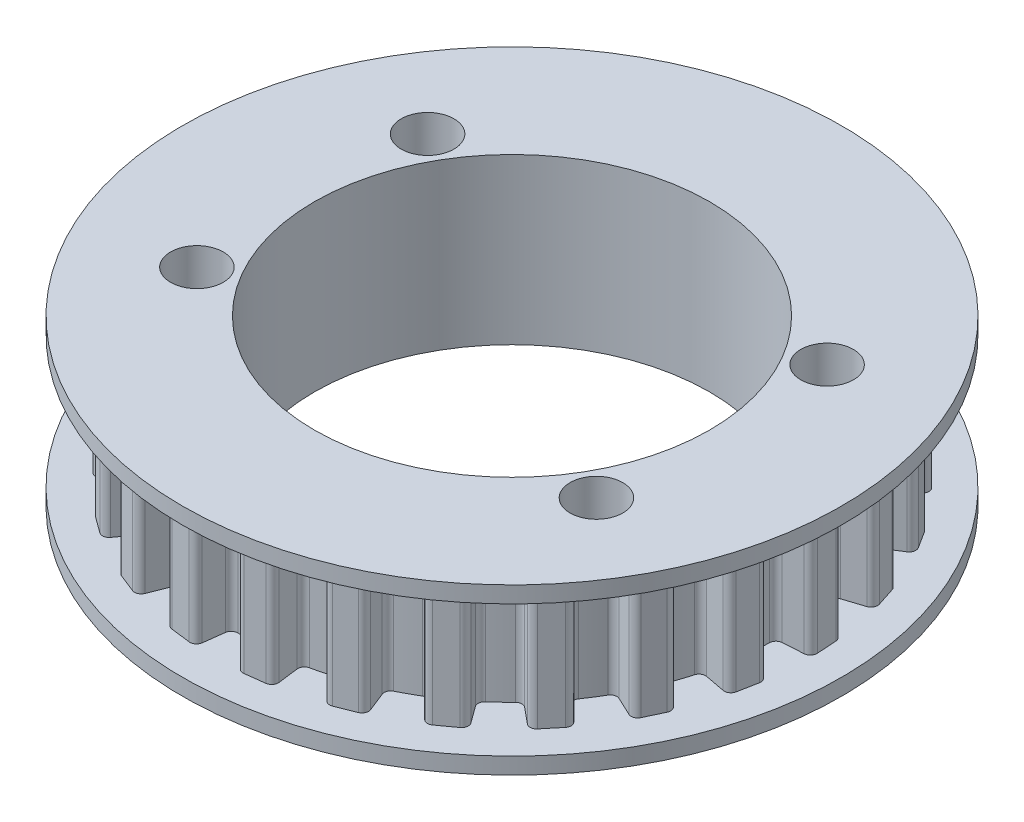
from build123d import *

# Parameters (mm, degrees)
CROQUIS1_R              = 30
SALIENTE_EXTRUIR1_DEPTH = 10
CROQUIS2_R              = 50
SALIENTE_EXTRUIR2_DEPTH = 2.5
SALIENTE_EXTRUIR3_START = 2.5
CROQUIS3_R              = 50
SALIENTE_EXTRUIR3_DEPTH = 2.5
CROQUIS4_R              = 30
CORTAR_EXTRUIR1_DEPTH   = 12.5
CROQUIS6_R              = 4
CORTAR_EXTRUIR2_DEPTH   = 10


with BuildPart() as part:
    # Croquis1 → Saliente-Extruir1 (new, symmetric)
    with BuildSketch(Plane(origin=(0, 0, 0), x_dir=(1, 0, 0), z_dir=(0, 1, 0))):
        with BuildLine():
            Line((-1.5, 45), (1.5, 45))
            ThreePointArc((1.5, 45), (2.207106781, 44.707106781), (2.5, 44))
            Line((2.5, 44), (2.5, 40.850336596))
            ThreePointArc((2.5, 40.850336596), (2.763329839, 40.17408437), (3.414634146, 39.853986923))
            ThreePointArc((3.414634146, 39.853986923), (5.013329343, 39.684588053), (6.603926375, 39.451085618))
            ThreePointArc((6.603926375, 39.451085618), (7.314373759, 39.59915382), (7.737607696, 40.188672871))
            Line((7.737607696, 40.188672871), (8.520897132, 43.239383808))
            ThreePointArc((8.520897132, 43.239383808), (8.980438878, 43.851435947), (9.738170181, 43.959277082))
            Line((9.738170181, 43.959277082), (12.643919664, 43.21320742))
            ThreePointArc((12.643919664, 43.21320742), (13.255971804, 42.753665675), (13.363812938, 41.995934372))
            Line((13.363812938, 41.995934372), (12.580523502, 38.945223435))
            ThreePointArc((12.580523502, 38.945223435), (12.667403259, 38.224729449), (13.218640646, 37.752715657))
            ThreePointArc((13.218640646, 37.752715657), (14.724982107, 37.191059436), (16.207537915, 36.569327513))
            ThreePointArc((16.207537915, 36.569327513), (16.932488352, 36.5360628), (17.489033043, 37.001807026))
            Line((17.489033043, 37.001807026), (19.00639496, 39.761878107))
            ThreePointArc((19.00639496, 39.761878107), (19.603710534, 40.240418119), (20.364455315, 40.156431113))
            Line((20.364455315, 40.156431113), (22.993375355, 38.711170091))
            ThreePointArc((22.993375355, 38.711170091), (23.471915366, 38.113854517), (23.387928361, 37.353109737))
            Line((23.387928361, 37.353109737), (21.870566443, 34.593038656))
            ThreePointArc((21.870566443, 34.593038656), (21.775537146, 33.873574196), (22.19207134, 33.279302421))
            ThreePointArc((22.19207134, 33.279302421), (23.511410092, 32.360679775), (24.792770241, 31.389784067))
            ThreePointArc((24.792770241, 31.389784067), (25.486672429, 31.177276585), (26.141558124, 31.489981563))
            Line((26.141558124, 31.489981563), (28.297651092, 33.785987371))
            ThreePointArc((28.297651092, 33.785987371), (28.995208961, 34.100946826), (29.711166826, 33.830408893))
            Line((29.711166826, 33.830408893), (31.898072708, 31.776767575))
            ThreePointArc((31.898072708, 31.776767575), (32.213032162, 31.079209707), (31.942494229, 30.363251842))
            Line((31.942494229, 30.363251842), (29.786401262, 28.067246033))
            ThreePointArc((29.786401262, 28.067246033), (29.515433948, 27.394017697), (29.771092575, 26.714828222))
            ThreePointArc((29.771092575, 26.714828222), (30.820529711, 25.49695959), (31.820181631, 24.237905045))
            ThreePointArc((31.820181631, 24.237905045), (32.439435144, 23.859507419), (33.151512967, 23.999524746))
            Line((33.151512967, 23.999524746), (35.810861735, 25.687198793))
            ThreePointArc((35.810861735, 25.687198793), (36.564831771, 25.818787629), (37.191016455, 25.378697662))
            Line((37.191016455, 25.378697662), (38.79849684, 22.845713886))
            ThreePointArc((38.79849684, 22.845713886), (38.930085676, 22.091743849), (38.48999571, 21.465559165))
            Line((38.48999571, 21.465559165), (35.830646942, 19.777885118))
            ThreePointArc((35.830646942, 19.777885118), (35.400767486, 19.193194319), (35.479486572, 18.471763115))
            ThreePointArc((35.479486572, 18.471763115), (36.193082099, 17.031171663), (36.848213983, 15.563069308))
            ThreePointArc((36.848213983, 15.563069308), (37.353908845, 15.042557653), (38.078436326, 15.001089525))
            Line((38.078436326, 15.001089525), (41.073944231, 15.974389043))
            ThreePointArc((41.073944231, 15.974389043), (41.836951725, 15.914339051), (42.334017742, 15.332349521))
            Line((42.334017742, 15.332349521), (43.261068725, 12.479179972))
            ThreePointArc((43.261068725, 12.479179972), (43.201018733, 11.716172478), (42.619029203, 11.219106462))
            Line((42.619029203, 11.219106462), (39.623521298, 10.245806943))
            ThreePointArc((39.623521298, 10.245806943), (39.061740607, 9.786391954), (38.958573944, 9.068049197))
            ThreePointArc((38.958573944, 9.068049197), (39.291490029, 7.495252583), (39.560937531, 5.91034869))
            ThreePointArc((39.560937531, 5.91034869), (39.921299075, 5.280428667), (40.612751489, 5.060080679))
            Line((40.612751489, 5.060080679), (43.756199752, 5.25784968))
            ThreePointArc((43.756199752, 5.25784968), (44.480302137, 5.009934022), (44.817017, 4.322613471))
            Line((44.817017, 4.322613471), (45.005388559, 1.328533286))
            ThreePointArc((45.005388559, 1.328533286), (44.7574729, 0.604430901), (44.07015235, 0.267716038))
            Line((44.07015235, 0.267716038), (40.926704087, 0.069947037))
            ThreePointArc((40.926704087, 0.069947037), (40.268320908, -0.235325409), (39.989750835, -0.905443602))
            ThreePointArc((39.989750835, -0.905443602), (39.921069137, -2.511620781), (39.78790188, -4.113740873))
            ThreePointArc((39.78790188, -4.113740873), (39.980287264, -4.813489072), (40.595218113, -5.198871646))
            Line((40.595218113, -5.198871646), (43.689092319, -5.789059715))
            ThreePointArc((43.689092319, -5.789059715), (44.328791578, -6.209263588), (44.483998255, -6.95872828))
            Line((44.483998255, -6.95872828), (43.921854311, -9.905590032))
            ThreePointArc((43.921854311, -9.905590032), (43.501650438, -10.545289292), (42.752185746, -10.700495969))
            Line((42.752185746, -10.700495969), (39.65831154, -10.110307899))
            ThreePointArc((39.65831154, -10.110307899), (38.944694508, -10.242256411), (38.50822461, -10.822044049))
            ThreePointArc((38.50822461, -10.822044049), (38.042260652, -12.360679775), (37.514846024, -13.879348968))
            ThreePointArc((37.514846024, -13.879348968), (37.527166967, -14.60495759), (38.026937883, -15.131159745))
            Line((38.026937883, -15.131159745), (40.876838537, -16.472221198))
            ThreePointArc((40.876838537, -16.472221198), (41.391940015, -17.03831033), (41.355886298, -17.802827542))
            Line((41.355886298, -17.802827542), (40.078548424, -20.517308699))
            ThreePointArc((40.078548424, -20.517308699), (39.512459291, -21.032410177), (38.74794208, -20.99635646))
            Line((38.74794208, -20.99635646), (35.898041425, -19.655295007))
            ThreePointArc((35.898041425, -19.655295007), (35.174029725, -19.605628775), (34.607085009, -20.058655668))
            ThreePointArc((34.607085009, -20.058655668), (33.77311702, -21.433071799), (32.884594423, -22.772866523))
            ThreePointArc((32.884594423, -22.772866523), (32.716076754, -23.478742909), (33.069285293, -24.112701429))
            Line((33.069285293, -24.112701429), (35.496142657, -26.120372442))
            ThreePointArc((35.496142657, -26.120372442), (35.854280631, -26.796777371), (35.62923191, -27.528309675))
            Line((35.62923191, -27.528309675), (33.71695994, -29.839849403))
            ThreePointArc((33.71695994, -29.839849403), (33.040555011, -30.197987378), (32.309022708, -29.972938656))
            Line((32.309022708, -29.972938656), (29.882165345, -27.965267642))
            ThreePointArc((29.882165345, -27.965267642), (29.193251293, -27.737107378), (28.53145498, -28.034908181))
            ThreePointArc((28.53145498, -28.034908181), (27.381884237, -29.158745097), (26.188082812, -30.235481121))
            ThreePointArc((26.188082812, -30.235481121), (25.849315117, -30.877272462), (26.033767888, -31.579153401))
            Line((26.033767888, -31.579153401), (27.885093587, -34.127284622))
            ThreePointArc((27.885093587, -34.127284622), (28.063764933, -34.871504339), (27.663861845, -35.524086868))
            Line((27.663861845, -35.524086868), (25.236810862, -37.287442625))
            ThreePointArc((25.236810862, -37.287442625), (24.492591144, -37.466113972), (23.840008615, -37.066210883))
            Line((23.840008615, -37.066210883), (21.988682916, -34.518079663))
            ThreePointArc((21.988682916, -34.518079663), (21.378153517, -34.125761515), (20.663088704, -34.249624307))
            ThreePointArc((20.663088704, -34.249624307), (19.270146964, -35.052267202), (17.846077646, -35.798289242))
            ThreePointArc((17.846077646, -35.798289242), (17.358345945, -36.335669429), (17.362453101, -37.061371026))
            Line((17.362453101, -37.061371026), (18.521921533, -39.989853997))
            ThreePointArc((18.521921533, -39.989853997), (18.509899673, -40.755126441), (17.9602696, -41.287755036))
            Line((17.9602696, -41.287755036), (15.170940142, -42.392128694))
            ThreePointArc((15.170940142, -42.392128694), (14.405667699, -42.380106834), (13.873039103, -41.830476761))
            Line((13.873039103, -41.830476761), (12.713570672, -38.901993789))
            ThreePointArc((12.713570672, -38.901993789), (12.219787732, -38.37016855), (11.496384571, -38.312310577))
            ThreePointArc((11.496384571, -38.312310577), (9.947595487, -38.743326445), (8.382737788, -39.111759193))
            ThreePointArc((8.382737788, -39.111759193), (7.776688057, -39.510962651), (7.600191531, -40.214886407))
            Line((7.600191531, -40.214886407), (7.99494903, -43.339713774))
            ThreePointArc((7.99494903, -43.339713774), (7.792989341, -44.077954061), (7.128167562, -44.457161709))
            Line((7.128167562, -44.457161709), (4.151823458, -44.833161409))
            ThreePointArc((4.151823458, -44.833161409), (3.413583171, -44.631201721), (3.034375524, -43.966379942))
            Line((3.034375524, -43.966379942), (2.639618024, -40.841552574))
            ThreePointArc((2.639618024, -40.841552574), (2.293607742, -40.203636779), (1.607320315, -39.967693471))
            ThreePointArc((1.607320315, -39.967693471), (0, -40), (-1.607320315, -39.967693471))
            ThreePointArc((-1.607320315, -39.967693471), (-2.293607742, -40.203636779), (-2.639618024, -40.841552574))
            Line((-2.639618024, -40.841552574), (-3.034375524, -43.966379942))
            ThreePointArc((-3.034375524, -43.966379942), (-3.413583171, -44.631201721), (-4.151823458, -44.833161409))
            Line((-4.151823458, -44.833161409), (-7.128167562, -44.457161709))
            ThreePointArc((-7.128167562, -44.457161709), (-7.792989341, -44.077954061), (-7.99494903, -43.339713774))
            Line((-7.99494903, -43.339713774), (-7.600191531, -40.214886407))
            ThreePointArc((-7.600191531, -40.214886407), (-7.776688057, -39.510962651), (-8.382737788, -39.111759193))
            ThreePointArc((-8.382737788, -39.111759193), (-9.947595487, -38.743326445), (-11.496384571, -38.312310577))
            ThreePointArc((-11.496384571, -38.312310577), (-12.219787732, -38.37016855), (-12.713570672, -38.901993789))
            Line((-12.713570672, -38.901993789), (-13.873039103, -41.830476761))
            ThreePointArc((-13.873039103, -41.830476761), (-14.405667699, -42.380106834), (-15.170940142, -42.392128694))
            Line((-15.170940142, -42.392128694), (-17.9602696, -41.287755036))
            ThreePointArc((-17.9602696, -41.287755036), (-18.509899673, -40.755126441), (-18.521921533, -39.989853997))
            Line((-18.521921533, -39.989853997), (-17.362453101, -37.061371026))
            ThreePointArc((-17.362453101, -37.061371026), (-17.358345945, -36.335669429), (-17.846077646, -35.798289242))
            ThreePointArc((-17.846077646, -35.798289242), (-19.270146964, -35.052267202), (-20.663088704, -34.249624307))
            ThreePointArc((-20.663088704, -34.249624307), (-21.378153517, -34.125761515), (-21.988682916, -34.518079663))
            Line((-21.988682916, -34.518079663), (-23.840008615, -37.066210883))
            ThreePointArc((-23.840008615, -37.066210883), (-24.492591144, -37.466113972), (-25.236810862, -37.287442625))
            Line((-25.236810862, -37.287442625), (-27.663861845, -35.524086868))
            ThreePointArc((-27.663861845, -35.524086868), (-28.063764933, -34.871504339), (-27.885093587, -34.127284622))
            Line((-27.885093587, -34.127284622), (-26.033767888, -31.579153401))
            ThreePointArc((-26.033767888, -31.579153401), (-25.849315117, -30.877272462), (-26.188082812, -30.235481121))
            ThreePointArc((-26.188082812, -30.235481121), (-27.381884237, -29.158745097), (-28.53145498, -28.034908181))
            ThreePointArc((-28.53145498, -28.034908181), (-29.193251293, -27.737107378), (-29.882165345, -27.965267642))
            Line((-29.882165345, -27.965267642), (-32.309022708, -29.972938656))
            ThreePointArc((-32.309022708, -29.972938656), (-33.040555011, -30.197987378), (-33.71695994, -29.839849403))
            Line((-33.71695994, -29.839849403), (-35.62923191, -27.528309675))
            ThreePointArc((-35.62923191, -27.528309675), (-35.854280631, -26.796777371), (-35.496142657, -26.120372442))
            Line((-35.496142657, -26.120372442), (-33.069285293, -24.112701429))
            ThreePointArc((-33.069285293, -24.112701429), (-32.716076754, -23.478742909), (-32.884594423, -22.772866523))
            ThreePointArc((-32.884594423, -22.772866523), (-33.77311702, -21.433071799), (-34.607085009, -20.058655668))
            ThreePointArc((-34.607085009, -20.058655668), (-35.174029725, -19.605628775), (-35.898041425, -19.655295007))
            Line((-35.898041425, -19.655295007), (-38.74794208, -20.99635646))
            ThreePointArc((-38.74794208, -20.99635646), (-39.512459291, -21.032410177), (-40.078548424, -20.517308699))
            Line((-40.078548424, -20.517308699), (-41.355886298, -17.802827542))
            ThreePointArc((-41.355886298, -17.802827542), (-41.391940015, -17.03831033), (-40.876838537, -16.472221198))
            Line((-40.876838537, -16.472221198), (-38.026937883, -15.131159745))
            ThreePointArc((-38.026937883, -15.131159745), (-37.527166967, -14.60495759), (-37.514846024, -13.879348968))
            ThreePointArc((-37.514846024, -13.879348968), (-38.042260652, -12.360679775), (-38.50822461, -10.822044049))
            ThreePointArc((-38.50822461, -10.822044049), (-38.944694508, -10.242256411), (-39.65831154, -10.110307899))
            Line((-39.65831154, -10.110307899), (-42.752185746, -10.700495969))
            ThreePointArc((-42.752185746, -10.700495969), (-43.501650438, -10.545289292), (-43.921854311, -9.905590032))
            Line((-43.921854311, -9.905590032), (-44.483998255, -6.95872828))
            ThreePointArc((-44.483998255, -6.95872828), (-44.328791578, -6.209263588), (-43.689092319, -5.789059715))
            Line((-43.689092319, -5.789059715), (-40.595218113, -5.198871646))
            ThreePointArc((-40.595218113, -5.198871646), (-39.980287264, -4.813489072), (-39.78790188, -4.113740873))
            ThreePointArc((-39.78790188, -4.113740873), (-39.921069137, -2.511620781), (-39.989750835, -0.905443602))
            ThreePointArc((-39.989750835, -0.905443602), (-40.268320908, -0.235325409), (-40.926704087, 0.069947037))
            Line((-40.926704087, 0.069947037), (-44.07015235, 0.267716038))
            ThreePointArc((-44.07015235, 0.267716038), (-44.7574729, 0.604430901), (-45.005388559, 1.328533286))
            Line((-45.005388559, 1.328533286), (-44.817017, 4.322613471))
            ThreePointArc((-44.817017, 4.322613471), (-44.480302137, 5.009934022), (-43.756199752, 5.25784968))
            Line((-43.756199752, 5.25784968), (-40.612751489, 5.060080679))
            ThreePointArc((-40.612751489, 5.060080679), (-39.921299075, 5.280428667), (-39.560937531, 5.91034869))
            ThreePointArc((-39.560937531, 5.91034869), (-39.291490029, 7.495252583), (-38.958573944, 9.068049197))
            ThreePointArc((-38.958573944, 9.068049197), (-39.061740607, 9.786391954), (-39.623521298, 10.245806943))
            Line((-39.623521298, 10.245806943), (-42.619029203, 11.219106462))
            ThreePointArc((-42.619029203, 11.219106462), (-43.201018733, 11.716172478), (-43.261068725, 12.479179972))
            Line((-43.261068725, 12.479179972), (-42.334017742, 15.332349521))
            ThreePointArc((-42.334017742, 15.332349521), (-41.836951725, 15.914339051), (-41.073944231, 15.974389043))
            Line((-41.073944231, 15.974389043), (-38.078436326, 15.001089525))
            ThreePointArc((-38.078436326, 15.001089525), (-37.353908845, 15.042557653), (-36.848213983, 15.563069308))
            ThreePointArc((-36.848213983, 15.563069308), (-36.193082099, 17.031171663), (-35.479486572, 18.471763115))
            ThreePointArc((-35.479486572, 18.471763115), (-35.400767486, 19.193194319), (-35.830646942, 19.777885118))
            Line((-35.830646942, 19.777885118), (-38.48999571, 21.465559165))
            ThreePointArc((-38.48999571, 21.465559165), (-38.930085676, 22.091743849), (-38.79849684, 22.845713886))
            Line((-38.79849684, 22.845713886), (-37.191016455, 25.378697662))
            ThreePointArc((-37.191016455, 25.378697662), (-36.564831771, 25.818787629), (-35.810861735, 25.687198793))
            Line((-35.810861735, 25.687198793), (-33.151512967, 23.999524746))
            ThreePointArc((-33.151512967, 23.999524746), (-32.439435144, 23.859507419), (-31.820181631, 24.237905045))
            ThreePointArc((-31.820181631, 24.237905045), (-30.820529711, 25.49695959), (-29.771092575, 26.714828222))
            ThreePointArc((-29.771092575, 26.714828222), (-29.515433948, 27.394017697), (-29.786401262, 28.067246033))
            Line((-29.786401262, 28.067246033), (-31.942494229, 30.363251842))
            ThreePointArc((-31.942494229, 30.363251842), (-32.213032162, 31.079209707), (-31.898072708, 31.776767575))
            Line((-31.898072708, 31.776767575), (-29.711166826, 33.830408893))
            ThreePointArc((-29.711166826, 33.830408893), (-28.995208961, 34.100946826), (-28.297651092, 33.785987371))
            Line((-28.297651092, 33.785987371), (-26.141558124, 31.489981563))
            ThreePointArc((-26.141558124, 31.489981563), (-25.486672429, 31.177276585), (-24.792770241, 31.389784067))
            ThreePointArc((-24.792770241, 31.389784067), (-23.511410092, 32.360679775), (-22.19207134, 33.279302421))
            ThreePointArc((-22.19207134, 33.279302421), (-21.775537146, 33.873574196), (-21.870566443, 34.593038656))
            Line((-21.870566443, 34.593038656), (-23.387928361, 37.353109737))
            ThreePointArc((-23.387928361, 37.353109737), (-23.471915366, 38.113854517), (-22.993375355, 38.711170091))
            Line((-22.993375355, 38.711170091), (-20.364455315, 40.156431113))
            ThreePointArc((-20.364455315, 40.156431113), (-19.603710534, 40.240418119), (-19.00639496, 39.761878107))
            Line((-19.00639496, 39.761878107), (-17.489033043, 37.001807026))
            ThreePointArc((-17.489033043, 37.001807026), (-16.932488352, 36.5360628), (-16.207537915, 36.569327513))
            ThreePointArc((-16.207537915, 36.569327513), (-14.724982107, 37.191059436), (-13.218640646, 37.752715657))
            ThreePointArc((-13.218640646, 37.752715657), (-12.667403259, 38.224729449), (-12.580523502, 38.945223435))
            Line((-12.580523502, 38.945223435), (-13.363812938, 41.995934372))
            ThreePointArc((-13.363812938, 41.995934372), (-13.255971804, 42.753665675), (-12.643919664, 43.21320742))
            Line((-12.643919664, 43.21320742), (-9.738170181, 43.959277082))
            ThreePointArc((-9.738170181, 43.959277082), (-8.980438878, 43.851435947), (-8.520897132, 43.239383808))
            Line((-8.520897132, 43.239383808), (-7.737607696, 40.188672871))
            ThreePointArc((-7.737607696, 40.188672871), (-7.314373759, 39.59915382), (-6.603926375, 39.451085618))
            ThreePointArc((-6.603926375, 39.451085618), (-5.013329343, 39.684588053), (-3.414634146, 39.853986923))
            ThreePointArc((-3.414634146, 39.853986923), (-2.763329839, 40.17408437), (-2.5, 40.850336596))
            Line((-2.5, 40.850336596), (-2.5, 44))
            ThreePointArc((-2.5, 44), (-2.207106781, 44.707106781), (-1.5, 45))
        make_face()
        with Locations(Location((0, 0, 0), (0, 0, 270))):
            Circle(CROQUIS1_R, mode=Mode.SUBTRACT)
    extrude(amount=SALIENTE_EXTRUIR1_DEPTH, both=True)

    # Croquis2 → Saliente-Extruir2 (add)
    with BuildSketch(Plane(origin=(0, 10, 0), x_dir=(1, 0, 0), z_dir=(0, 1, 0))):
        with Locations(Location((0, 0, 0), (0, 0, 270))):
            Circle(CROQUIS2_R)
    extrude(amount=SALIENTE_EXTRUIR2_DEPTH)

    # Croquis3 → Saliente-Extruir3 (add)
    with BuildSketch(Plane.XZ.offset(10).offset(SALIENTE_EXTRUIR3_START)):
        with Locations(Location((0, 0, 0), (0, 0, 90))):
            Circle(CROQUIS3_R)
    extrude(amount=-SALIENTE_EXTRUIR3_DEPTH)

    # Croquis4 → Cortar-Extruir1 (cut, symmetric)
    with BuildSketch(Plane(origin=(0, 0, 0), x_dir=(1, 0, 0), z_dir=(0, 1, 0))):
        with Locations(Location((0, 0, 0), (0, 0, 270))):
            Circle(CROQUIS4_R)
    extrude(amount=CORTAR_EXTRUIR1_DEPTH, both=True, mode=Mode.SUBTRACT)

    # Croquis6 → Cortar-Extruir2 (cut)
    with BuildSketch(Plane(origin=(0, 12.5, 0), x_dir=(1, 0, 0), z_dir=(0, 1, 0))):
        with Locations(Location((30.310889132, 17.5, 0), (0, 0, 270))):
            Circle(CROQUIS6_R)
        with Locations(Location((30.310889132, -17.5, 0), (0, 0, 90))):
            Circle(CROQUIS6_R)
        with Locations(Location((-30.310889132, -17.5, 0), (0, 0, 270))):
            Circle(CROQUIS6_R)
        with Locations(Location((-30.310889132, 17.5, 0), (0, 0, 90))):
            Circle(CROQUIS6_R)
    extrude(amount=-CORTAR_EXTRUIR2_DEPTH, mode=Mode.SUBTRACT)


solid = part.part
